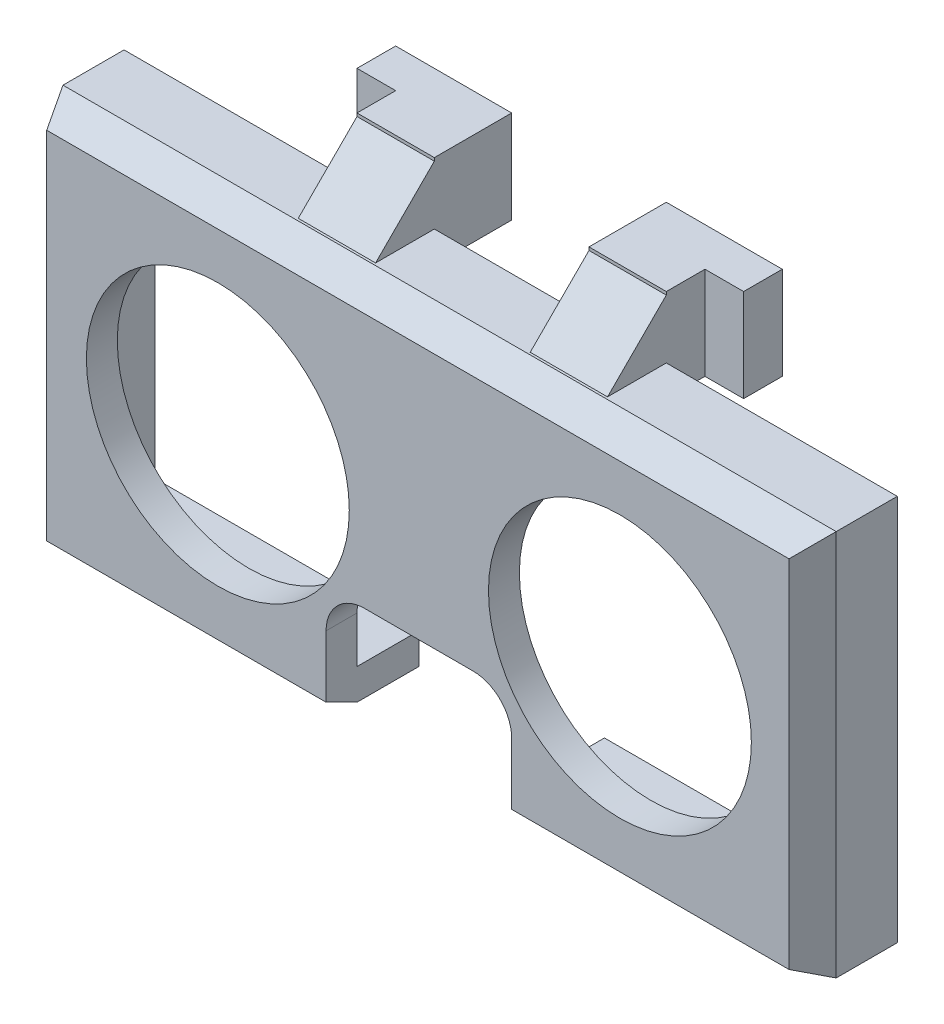
from build123d import *

# Parameters (mm, degrees)
SKETCH1_R                = 8.5
BOSS_EXTRUDE1_DEPTH      = 2
BOSS_EXTRUDE2_DEPTH      = 4
BOSS_EXTRUDE2_DEPTH_BACK = 2
CHAMFER1_SIZE            = 1
CHAMFER1_SIZE2           = 2.050303842
CUT_EXTRUDE1_DEPTH       = 1
SKETCH5_W                = 5
SKETCH5_H                = 2.5
BOSS_EXTRUDE3_DEPTH      = 6
CHAMFER2_SIZE            = 3.8


with BuildPart() as part:
    # Sketch1 → Boss-Extrude1 (new body)
    # profile 1 of 2: a face of its own
    with BuildSketch(Plane.XY):
        with BuildLine():
            Line((-22.564385508, -10.000007952), (-6, -10.000007952))
            Line((-6, -10.000007952), (-6, -7.5))
            ThreePointArc((-6, -7.5), (-5.267766953, -5.732233047), (-3.5, -5))
            Line((-3.5, -5), (3.5, -5))
            ThreePointArc((3.5, -5), (5.267766953, -5.732233047), (6, -7.5))
            Line((6, -7.5), (6, -10.000007952))
            Line((6, -10.000007952), (22.435614492, -10.000007952))
            Line((22.435614492, -10.000007952), (22.435614492, 9.999992048))
            Line((22.435614492, 9.999992048), (-22.564385508, 9.999992048))
            Line((-22.564385508, 9.999992048), (-22.564385508, -10.000007952))
        make_face()
        with Locations((-13, 0)):
            Circle(SKETCH1_R, mode=Mode.SUBTRACT)
        with Locations((13, 0)):
            Circle(SKETCH1_R, mode=Mode.SUBTRACT)
    # profile 2 of 2: a face of its own
    with BuildSketch(Plane.XY):
        Polygon((-6, -10.500007952), (-6, -10.000007952), (-22.564385508, -10.000007952), (-22.564385508, 9.999992048), (22.435614492, 9.999992048), (22.435614492, -10.000007952), (6, -10.000007952), (6, -10.500007952), (22.935614492, -10.500007952), (22.935614492, 10.499992048), (-23.064385508, 10.499992048), (-23.064385508, -10.500007952), align=None)
    extrude(amount=BOSS_EXTRUDE1_DEPTH)

    # Sketch2 → Boss-Extrude2 (add, two sides: drawn at the far end of the back side and taken through both)
    with BuildSketch(Plane(origin=(0, 0, 0), x_dir=(-1, 0, 0), z_dir=(0, 0, -1)).offset(-BOSS_EXTRUDE2_DEPTH_BACK)):
        Polygon((6, -12.500007952), (25.064385508, -12.500007952), (25.064385508, 12.499992048), (-24.935614492, 12.499992048), (-24.935614492, -12.500007952), (-6, -12.500007952), (-6, -10.500007952), (-22.935614492, -10.500007952), (-22.935614492, 10.499992048), (23.064385508, 10.499992048), (23.064385508, -10.500007952), (6, -10.500007952), align=None)
    extrude(amount=BOSS_EXTRUDE2_DEPTH + BOSS_EXTRUDE2_DEPTH_BACK)

    # Chamfer1
    chamfer1_edges = [part.edges().sort_by_distance(p)[0] for p in [
        (-15.532192754, -12.500007952, 2),
        (-25.064385508, -7.952e-06, 2),
        (-0.064385508, 12.499992048, 2),
        (24.935614492, -7.952e-06, 2),
        (15.467807246, -12.500007952, 2),
    ]]
    chamfer1_side = [part.faces().sort_by_distance(p)[0] for p in [
        (-0.113559128, 1.090103523, 2),
    ]]
    chamfer(chamfer1_edges, length=CHAMFER1_SIZE, length2=CHAMFER1_SIZE2, reference=chamfer1_side[0])

    # Sketch3 → Cut-Extrude1 (cut)
    with BuildSketch(Plane(origin=(0, 0, 0), x_dir=(-1, 0, 0), z_dir=(0, 0, -1))):
        with BuildLine():
            Line((-5, 9.949992048), (5, 9.949992048))
            ThreePointArc((5, 9.949992048), (6.2, 8.749992048), (5, 7.549992048))
            Line((5, 7.549992048), (-5, 7.549992048))
            ThreePointArc((-5, 7.549992048), (-6.2, 8.749992048), (-5, 9.949992048))
        make_face()
    extrude(amount=-CUT_EXTRUDE1_DEPTH, mode=Mode.SUBTRACT)

    # Sketch5 → Boss-Extrude3 (add)
    with BuildSketch(Plane.XZ.offset(-10.499992048)):
        with Locations((7.5, -5.25)):
            Rectangle(SKETCH5_W, SKETCH5_H)
        Polygon((10, -6.5), (5, -6.5), (5, -9), (12.5, -9), (12.5, -6.5), align=None)
        with Locations((-7.5, -5.25)):
            Rectangle(SKETCH5_W, SKETCH5_H)
        Polygon((-5, -9), (-5, -6.5), (-10, -6.5), (-12.5, -6.5), (-12.5, -9), align=None)
    extrude(amount=-BOSS_EXTRUDE3_DEPTH)

    # Chamfer2
    chamfer2_edges = [part.edges().sort_by_distance(p)[0] for p in [
        (7.5, 12.499992048, -4),
        (-7.5, 12.499992048, -4),
    ]]
    chamfer(chamfer2_edges, length=CHAMFER2_SIZE)


solid = part.part
